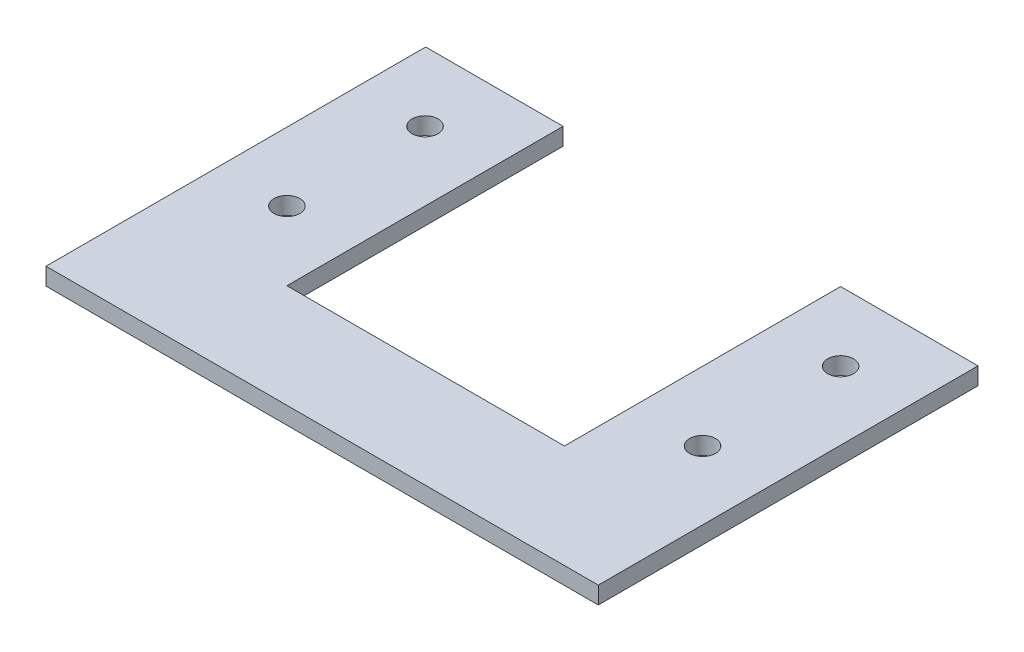
from build123d import *

# Parameters (mm, degrees)
SKETCH1_R           = 2.38125
BOSS_EXTRUDE1_DEPTH = 3.175


with BuildPart() as part:
    # Sketch1 → Boss-Extrude1 (new body)
    with BuildSketch(Plane(origin=(0, 0, 0), x_dir=(1, 0, 0), z_dir=(0, 1, 0))):
        Polygon((-25.527, 34.925), (-50.8, 34.925), (-50.8, -34.925), (50.8, -34.925), (50.8, 34.925), (25.527, 34.925), (25.527, -15.875), (-25.527, -15.875), align=None)
        with Locations(Location((-38.227, -3.175, 0), (0, 0, 270))):
            Circle(SKETCH1_R, mode=Mode.SUBTRACT)
        with Locations(Location((38.227, -3.175, 0), (0, 0, 270))):
            Circle(SKETCH1_R, mode=Mode.SUBTRACT)
        with Locations(Location((-38.227, 22.225, 0), (0, 0, 270))):
            Circle(SKETCH1_R, mode=Mode.SUBTRACT)
        with Locations(Location((38.227, 22.225, 0), (0, 0, 270))):
            Circle(SKETCH1_R, mode=Mode.SUBTRACT)
    extrude(amount=BOSS_EXTRUDE1_DEPTH)


solid = part.part
